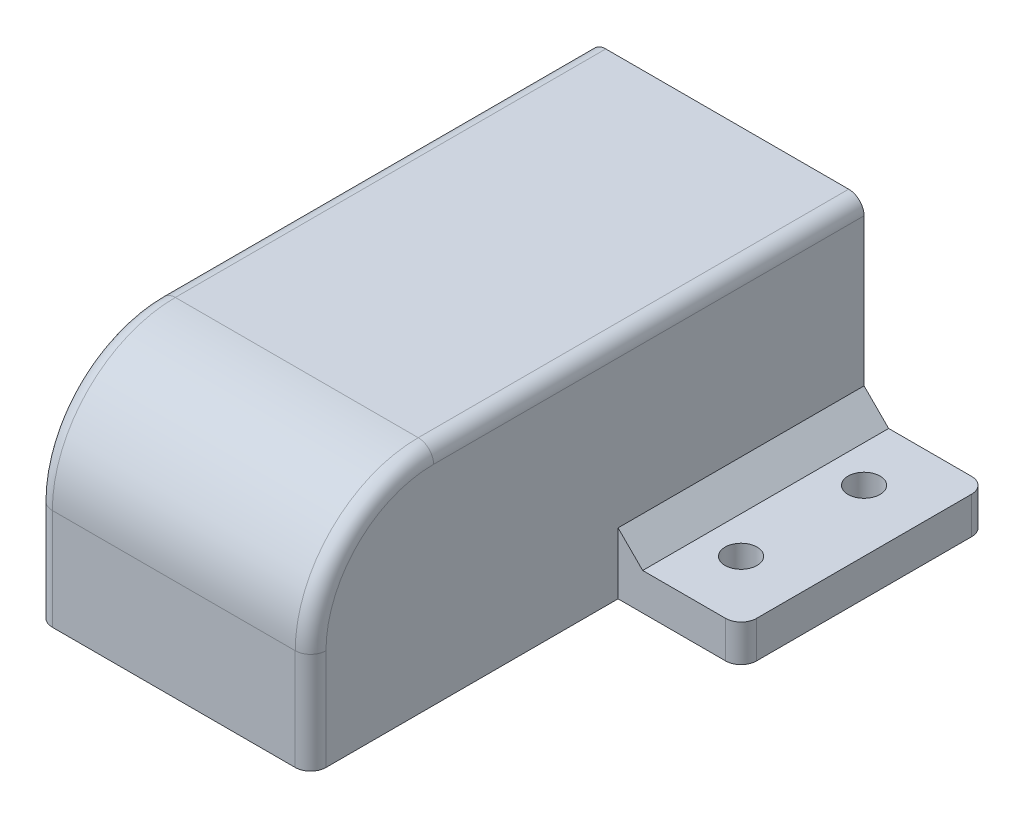
from build123d import *

# Parameters (mm, degrees)
SKETCH_2_W              = 44.5
SKETCH_2_H              = 40.4
EXTRUDE_1_DEPTH         = 90
SKETCH_1_W              = 33.8
SKETCH_1_H              = 25.5
CUT_EXTRUDE_1_DEPTH     = 11.5
SKETCH_3_W              = 36.2
SKETCH_3_H              = 32.5
CUT_EXTRUDE_2_DEPTH     = 28.2
SKETCH_4_W              = 38.7
SKETCH_4_H              = 34.6
CUT_EXTRUDE_3_DEPTH     = 21.8
CUT_EXTRUDE_4_DEPTH     = 3
SKETCH_7_W              = 44.5
SKETCH_7_H              = 90
CUT_EXTRUDE_6_DEPTH     = 3.95
CUT_EXTRUDE_START       = -3
CUT_EXTRUDE_5_DEPTH     = 38.5
SKETCH_8_W              = 20
SKETCH_8_H              = 40
EXTRUDE_2_DEPTH         = 6
SKETCH_9_R              = 2.6
CUT_EXTRUDE_7_DEPTH     = 104.982041719
FILLET_1_R              = 2.5
FILLET_2_R              = 4.5
FILLET_3_R              = 1.5
FILLET_4_R              = 20
FILLET_5_R              = 2.5
CHAMFER_1_SIZE          = 1
CHAMFER_2_SIZE          = 4
SHEET_EXTRUDE_1_1_BACK  = 40
SHEET_EXTRUDE_1_1_DEPTH = 40
SHEET_EXTRUDE_1_2_BACK  = 40
SHEET_EXTRUDE_1_2_DEPTH = 40


with BuildPart() as part:
    # Эскиз2 → Бобышка-Вытянуть1 (new body)
    with BuildSketch(Plane.XY):
        Rectangle(SKETCH_2_W, SKETCH_2_H)
    extrude(amount=EXTRUDE_1_DEPTH)

    # Эскиз1 → Вырез-Вытянуть1 (cut)
    with BuildSketch(Plane.XY):
        Rectangle(SKETCH_1_W, SKETCH_1_H)
    extrude(amount=CUT_EXTRUDE_1_DEPTH, mode=Mode.SUBTRACT)

    # Эскиз3 → Вырез-Вытянуть2 (cut)
    with BuildSketch(Plane(origin=(0, 0, 11.5), x_dir=(-1, 0, 0), z_dir=(0, 0, -1))):
        Rectangle(SKETCH_3_W, SKETCH_3_H)
    extrude(amount=-CUT_EXTRUDE_2_DEPTH, mode=Mode.SUBTRACT)

    # Эскиз4 → Вырез-Вытянуть3 (cut)
    with BuildSketch(Plane(origin=(0, 0, 39.7), x_dir=(-1, 0, 0), z_dir=(0, 0, -1))):
        Rectangle(SKETCH_4_W, SKETCH_4_H)
    extrude(amount=-CUT_EXTRUDE_3_DEPTH, mode=Mode.SUBTRACT)

    # Эскиз5 → Вырез-Вытянуть4 (cut)
    with BuildSketch(Plane(origin=(0, 0, 61.5), x_dir=(-1, 0, 0), z_dir=(0, 0, -1))):
        with BuildLine():
            Line((-7.5, 0), (-7.5, -17.3))
            Line((-7.5, -17.3), (7.5, -17.3))
            Line((7.5, -17.3), (7.5, 0))
            ThreePointArc((7.5, 0), (0, 7.5), (-7.5, 0))
        make_face()
    extrude(amount=-CUT_EXTRUDE_4_DEPTH, mode=Mode.SUBTRACT)

    # Эскиз7 → Вырез-Вытянуть6 (cut)
    with BuildSketch(Plane.XZ.offset(20.2)):
        with Locations((0, 45)):
            Rectangle(SKETCH_7_W, SKETCH_7_H)
    extrude(amount=-CUT_EXTRUDE_6_DEPTH, mode=Mode.SUBTRACT)

    # Эскиз6 → Вырез-Вытянуть5 (cut)
    with BuildSketch(Plane(origin=(22.25, 0, 0), x_dir=(0, 0, -1), z_dir=(1, 0, 0)).offset(CUT_EXTRUDE_START)):
        with BuildLine():
            Line((-67, 17.2), (-64.5, 17.2))
            Line((-64.5, 17.2), (-64.5, -16.25))
            Line((-64.5, -16.25), (-87, -16.25))
            Line((-87, -16.25), (-87, -2.8))
            ThreePointArc((-87, -2.8), (-81.142135624, 11.342135624), (-67, 17.2))
        make_face()
    extrude(amount=-CUT_EXTRUDE_5_DEPTH, mode=Mode.SUBTRACT)

    # Эскиз8 → Бобышка-Вытянуть2 (add)
    with BuildSketch(Plane.XZ.offset(16.25)):
        with Locations((32.25, 20)):
            Rectangle(SKETCH_8_W, SKETCH_8_H)
    extrude_2 = extrude(amount=-EXTRUDE_2_DEPTH)

    # Эскиз9 → Вырез-Вытянуть7 (cut, through all)
    with BuildSketch(Plane(origin=(0, -10.25, 0), x_dir=(1, 0, 0), z_dir=(0, 1, 0))):
        with Locations(Location((32.25, -10, 0), (0, 0, 270))):
            Circle(SKETCH_9_R)
        with Locations(Location((32.25, -30, 0), (0, 0, 270))):
            Circle(SKETCH_9_R)
    cut_extrude_7 = extrude(amount=-CUT_EXTRUDE_7_DEPTH, mode=Mode.SUBTRACT)

    # Зеркальное отражение1: Бобышка-Вытянуть2, Вырез-Вытянуть7 across plane
    add(extrude_2.mirror(Plane(origin=(0, 0, 0), x_dir=(0, 0, 1), z_dir=(1, 0, 0))))
    add(cut_extrude_7.mirror(Plane(origin=(0, 0, 0), x_dir=(0, 0, 1), z_dir=(1, 0, 0))), mode=Mode.SUBTRACT)

    # Скругление1
    fillet_1_edges = [part.edges().sort_by_distance(p)[0] for p in [
        (42.25, -13.25, 40),
        (42.25, -13.25, 0),
        (-42.25, -13.25, 0),
        (-42.25, -13.25, 40),
    ]]
    fillet(fillet_1_edges, radius=FILLET_1_R)

    # Скругление2
    fillet_2_edges = [part.edges().sort_by_distance(p)[0] for p in [
        (-16.9, 12.75, 5.75),
        (-16.9, -12.75, 5.75),
        (16.9, -12.75, 5.75),
        (16.9, 12.75, 5.75),
        (18.1, 16.25, 25.6),
        (-18.1, 16.25, 25.6),
    ]]
    fillet(fillet_2_edges, radius=FILLET_2_R)

    # Скругление3
    fillet_3_edges = [part.edges().sort_by_distance(p)[0] for p in [
        (19.35, 17.3, 50.6),
        (-19.35, 17.3, 50.6),
    ]]
    fillet(fillet_3_edges, radius=FILLET_3_R)

    # Скругление4
    fillet_4_edges = [part.edges().sort_by_distance(p)[0] for p in [
        (0, 20.2, 90),
    ]]
    fillet(fillet_4_edges, radius=FILLET_4_R)

    # Скругление5
    fillet_5_edges = [part.edges().sort_by_distance(p)[0] for p in [
        (19.25, 17.2, 65.75),
        (19.25, 11.342135624, 81.142135624),
        (19.25, -9.525, 87),
        (-19.25, -9.525, 87),
        (-19.25, 11.342135624, 81.142135624),
        (-19.25, 17.2, 65.75),
        (-22.25, -8.025, 90),
        (-22.25, 20.2, 35),
        (-22.25, 14.342135624, 84.142135624),
        (22.25, 20.2, 35),
        (22.25, 14.342135624, 84.142135624),
        (22.25, -8.025, 90),
    ]]
    fillet(fillet_5_edges, radius=FILLET_5_R)

    # Фаска1
    chamfer_1_edges = [part.edges().sort_by_distance(p)[0] for p in [
        (19.25, -0.775, 64.5),
        (0, 17.2, 64.5),
        (-19.25, -0.775, 64.5),
        (18.517766953, 16.467766953, 64.5),
        (-18.517766953, 16.467766953, 64.5),
    ]]
    chamfer(chamfer_1_edges, length=CHAMFER_1_SIZE)

    # Фаска2
    chamfer_2_edges = [part.edges().sort_by_distance(p)[0] for p in [
        (22.25, -10.25, 20),
        (-22.25, -10.25, 20),
    ]]
    chamfer(chamfer_2_edges, length=CHAMFER_2_SIZE)


with BuildPart() as body_2:
    # Split Bodies 2: the piece behind the surface
    add(part.part)
    # Sheet Бобышка-Вытянуть1: a surface, the sketch's curves swept straight by 40 mm
    with BuildLine(Plane(origin=(0, 0, 0), x_dir=(-1, 0, 0), z_dir=(0, 0, -1)).offset(-SHEET_EXTRUDE_1_1_BACK), mode=Mode.PRIVATE) as sheet_extrude_1_1_path:
        Line((-19.35, 3.75), (19.35, 3.75))
        Line((19.35, 3.75), (19.35, -16.25))
        Line((19.35, -16.25), (-19.35, -16.25))
        Line((-19.35, -16.25), (-19.35, 3.75))
    sheet_extrude_1_1 = Shell.extrude(sheet_extrude_1_1_path.wire(), (0 * SHEET_EXTRUDE_1_1_DEPTH, 0 * SHEET_EXTRUDE_1_1_DEPTH, -1 * SHEET_EXTRUDE_1_1_DEPTH))
    split(bisect_by=sheet_extrude_1_1, keep=Keep.BOTTOM)


with BuildPart() as part_1:
    add(part.part)

    # Split Bodies 2: split by a surface, the side it looks to stays
    # Sheet Бобышка-Вытянуть1: a surface, the sketch's curves swept straight by 40 mm
    with BuildLine(Plane(origin=(0, 0, 0), x_dir=(-1, 0, 0), z_dir=(0, 0, -1)).offset(-SHEET_EXTRUDE_1_2_BACK), mode=Mode.PRIVATE) as sheet_extrude_1_2_path:
        Line((-19.35, 3.75), (19.35, 3.75))
        Line((19.35, 3.75), (19.35, -16.25))
        Line((19.35, -16.25), (-19.35, -16.25))
        Line((-19.35, -16.25), (-19.35, 3.75))
    sheet_extrude_1_2 = Shell.extrude(sheet_extrude_1_2_path.wire(), (0 * SHEET_EXTRUDE_1_2_DEPTH, 0 * SHEET_EXTRUDE_1_2_DEPTH, -1 * SHEET_EXTRUDE_1_2_DEPTH))
    split(bisect_by=sheet_extrude_1_2, keep=Keep.TOP)


solid = Compound([body_2.part, part_1.part])
